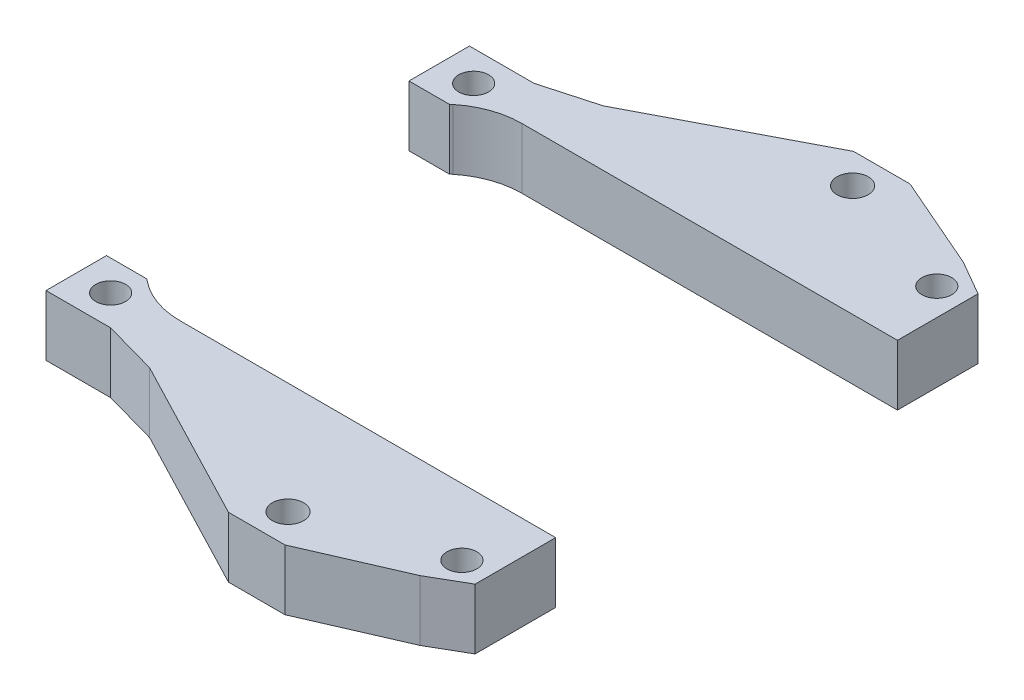
from build123d import *

# Parameters (mm, degrees)
SKETCH_1_W          = 80
SKETCH_1_H          = 62
EXTRUDE_1_DEPTH     = 6
CUT_EXTRUDE_1_DEPTH = 20
SKETCH_4_R          = 1.55
CUT_EXTRUDE_2_DEPTH = 20
SKETCH_5_R          = 1.55
CUT_EXTRUDE_3_DEPTH = 20
SKETCH_6_R          = 1.48
SKETCH_6_W          = 18
SKETCH_6_H          = 6
CUT_EXTRUDE_4_DEPTH = 20
SKETCH_7_R          = 1.48
SKETCH_7_W          = 18
SKETCH_7_H          = 6
CUT_EXTRUDE_5_DEPTH = 20
CUT_EXTRUDE_6_DEPTH = 20
CUT_EXTRUDE_7_DEPTH = 20
FILLET_3_R          = 8
FILLET_4_R          = 8


with BuildPart() as part:
    # 草图1 → 凸台-拉伸1 (new body)
    with BuildSketch(Plane(origin=(0, 0, 0), x_dir=(1, 0, 0), z_dir=(0, 1, 0))):
        Rectangle(SKETCH_1_W, SKETCH_1_H)
    extrude(amount=EXTRUDE_1_DEPTH)

    # 草图2 → 切除-拉伸1 (cut)
    with BuildSketch(Plane.XZ):
        Polygon((40, -16.95), (40, 16.95), (12.215250205, 16.95), (-0.084749795, 16.95), (-2.5, 15), (-24.5, 15), (-24.5, 21), (-0.084749795, 21), (5.277568136, 22.5), (20, 31), (-40, 31), (-40, -31), (20, -31), (5.277568136, -22.5), (-0.084749795, -21), (-24.5, -21), (-24.5, -15), (-2.5, -15), (-0.084749795, -16.95), (12.215250205, -16.95), align=None)
        Polygon((29.5, 31), (40, 24.937822174), (40, 31), align=None)
        Polygon((40, -31), (40, -24.937822174), (29.5, -31), align=None)
    extrude(amount=-CUT_EXTRUDE_1_DEPTH, mode=Mode.SUBTRACT)


with BuildPart() as cut_extrude_1_piece_1:
    # of the separate pieces the step leaves, piece 1, a body of its own (cut_extrude_1_pieces)
    add(part.part.solids().sort_by_distance((20, 0, -31))[0])

    # 草图4 → 切除-拉伸2 (cut)
    with BuildSketch(Plane(origin=(0, 6, 0), x_dir=(1, 0, 0), z_dir=(0, 1, 0))):
        with Locations(Location((24.5, 28, 0), (0, 0, 270))):
            Circle(SKETCH_4_R)
    extrude(amount=-CUT_EXTRUDE_2_DEPTH, mode=Mode.SUBTRACT)

    # 草图6 → 切除-拉伸4 (cut)
    with BuildSketch(Plane.XZ):
        with Locations(Location((37.3, -23.55, 0), (0, 0, 270))):
            Circle(SKETCH_6_R)
        with Locations(Location((-3.084749795, -18, 0), (0, 0, 270))):
            Circle(SKETCH_6_R)
        with Locations((-15.5, -18)):
            Rectangle(SKETCH_6_W, SKETCH_6_H)
    extrude(amount=-CUT_EXTRUDE_4_DEPTH, mode=Mode.SUBTRACT)

    # 草图8 → 切除-拉伸6 (cut)
    with BuildSketch(Plane(origin=(0, 6, 0), x_dir=(1, 0, 0), z_dir=(0, 1, 0))):
        Polygon((20, 31), (5.277568136, 22.5), (21.6, 31), align=None)
        Polygon((29.5, 31), (27.2, 31), (36.535898385, 26.937822174), align=None)
    extrude(amount=-CUT_EXTRUDE_6_DEPTH, mode=Mode.SUBTRACT)

    # 圆角3
    fillet_3_edges = [cut_extrude_1_piece_1.edges().sort_by_distance(p)[0] for p in [
        (-0.084749795, 3, -16.95),
    ]]
    fillet(fillet_3_edges, radius=FILLET_3_R)


with BuildPart() as cut_extrude_1_piece_2:
    # of the separate pieces the step leaves, piece 2, a body of its own (cut_extrude_1_pieces)
    add(part.part.solids().sort_by_distance((29.5, 0, 31))[0])

    # 草图5 → 切除-拉伸3 (cut)
    with BuildSketch(Plane(origin=(0, 6, 0), x_dir=(1, 0, 0), z_dir=(0, 1, 0))):
        with Locations(Location((24.5, -28, 0), (0, 0, 270))):
            Circle(SKETCH_5_R)
    extrude(amount=-CUT_EXTRUDE_3_DEPTH, mode=Mode.SUBTRACT)

    # 草图7 → 切除-拉伸5 (cut)
    with BuildSketch(Plane.XZ):
        with Locations(Location((37.3, 23.55, 0), (0, 0, 270))):
            Circle(SKETCH_7_R)
        with Locations(Location((-3.084749795, 18, 0), (0, 0, 270))):
            Circle(SKETCH_7_R)
        with Locations((-15.5, 18)):
            Rectangle(SKETCH_7_W, SKETCH_7_H)
    extrude(amount=-CUT_EXTRUDE_5_DEPTH, mode=Mode.SUBTRACT)

    # 草图9 → 切除-拉伸7 (cut)
    with BuildSketch(Plane(origin=(0, 6, 0), x_dir=(1, 0, 0), z_dir=(0, 1, 0))):
        Polygon((21.6, -31), (5.277568136, -22.5), (20, -31), align=None)
        Polygon((36.535898385, -26.937822174), (27.2, -31), (29.5, -31), align=None)
    extrude(amount=-CUT_EXTRUDE_7_DEPTH, mode=Mode.SUBTRACT)

    # 圆角4
    fillet_4_edges = [cut_extrude_1_piece_2.edges().sort_by_distance(p)[0] for p in [
        (-0.084749795, 3, 16.95),
    ]]
    fillet(fillet_4_edges, radius=FILLET_4_R)


solid = Compound([cut_extrude_1_piece_1.part, cut_extrude_1_piece_2.part])
